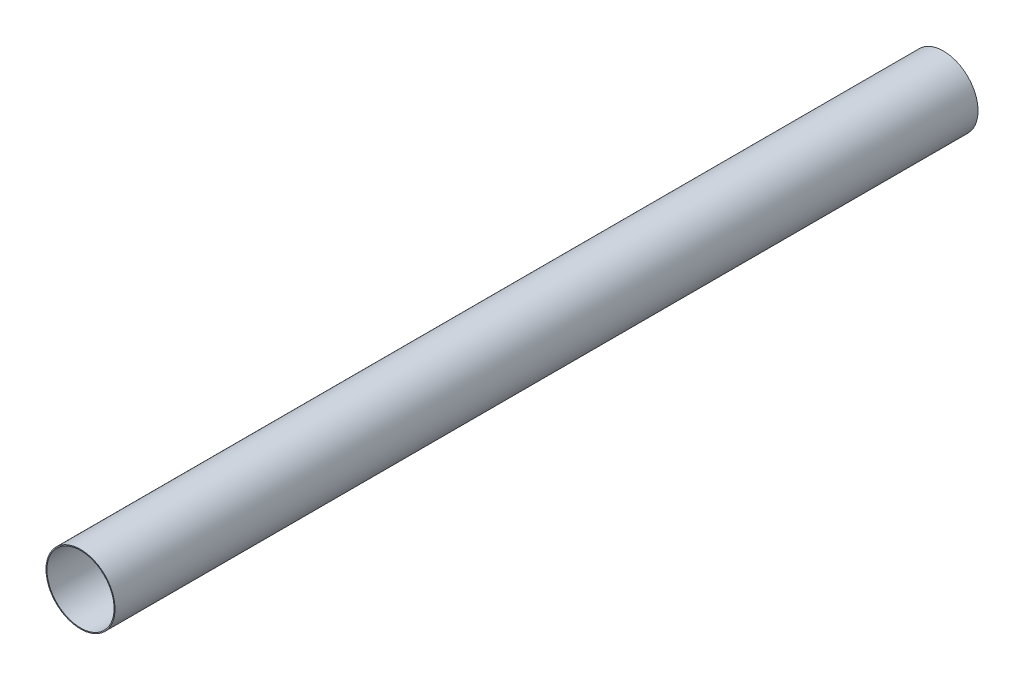
from build123d import *

# Parameters (mm, degrees)
SKETCH1_R           = 50.8
SKETCH1_R_2         = 49.403
BOSS_EXTRUDE1_DEPTH = 1270


with BuildPart() as part:
    # Sketch1 → Boss-Extrude1 (new body)
    with BuildSketch(Plane.XY):
        with Locations(Location((0, 0, 0), (0, 0, 180))):
            Circle(SKETCH1_R)
        with Locations(Location((0, 0, 0), (0, 0, 180))):
            Circle(SKETCH1_R_2, mode=Mode.SUBTRACT)
    extrude(amount=BOSS_EXTRUDE1_DEPTH)


solid = part.part
